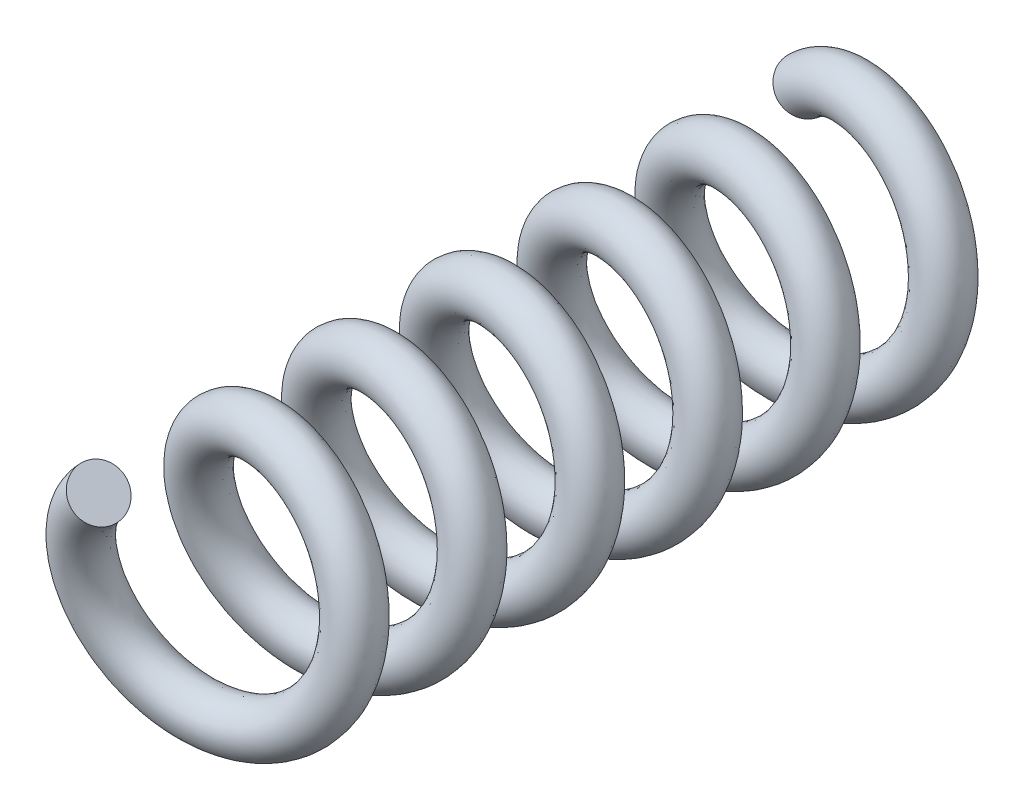
from build123d import *

# Parameters (mm, degrees)
SWEEP1_PITCH       = 16.721666667
SWEEP1_HEIGHT      = 100.33
SWEEP1_RADIUS      = 15
SWEEP1_START_ANGLE = 135
SWEEP1_PROFILE_R   = 3.5


with BuildPart() as part:
    # Sweep1: sweep along a helix
    with BuildLine() as sweep1_path:
        add(Helix(SWEEP1_PITCH, SWEEP1_HEIGHT, SWEEP1_RADIUS, center=(0, 0, 0), direction=(0, 0, 1), lefthand=True, mode=Mode.PRIVATE).rotate(Axis((0, 0, 0), (0, 0, 1)), SWEEP1_START_ANGLE))
    # Sweep1 profile (on start of the path) → Sweep1 (sweep)
    with BuildSketch(Plane(origin=(-10.606601718, 10.606601718, 0), x_dir=(0.7071067811866592, -0.7071067811864362, 0), z_dir=(0.6962334244018221, 0.6962334244020416, 0.17469412551977548))):
        Circle(SWEEP1_PROFILE_R)
    sweep(path=sweep1_path.line, is_frenet=True)


solid = part.part
